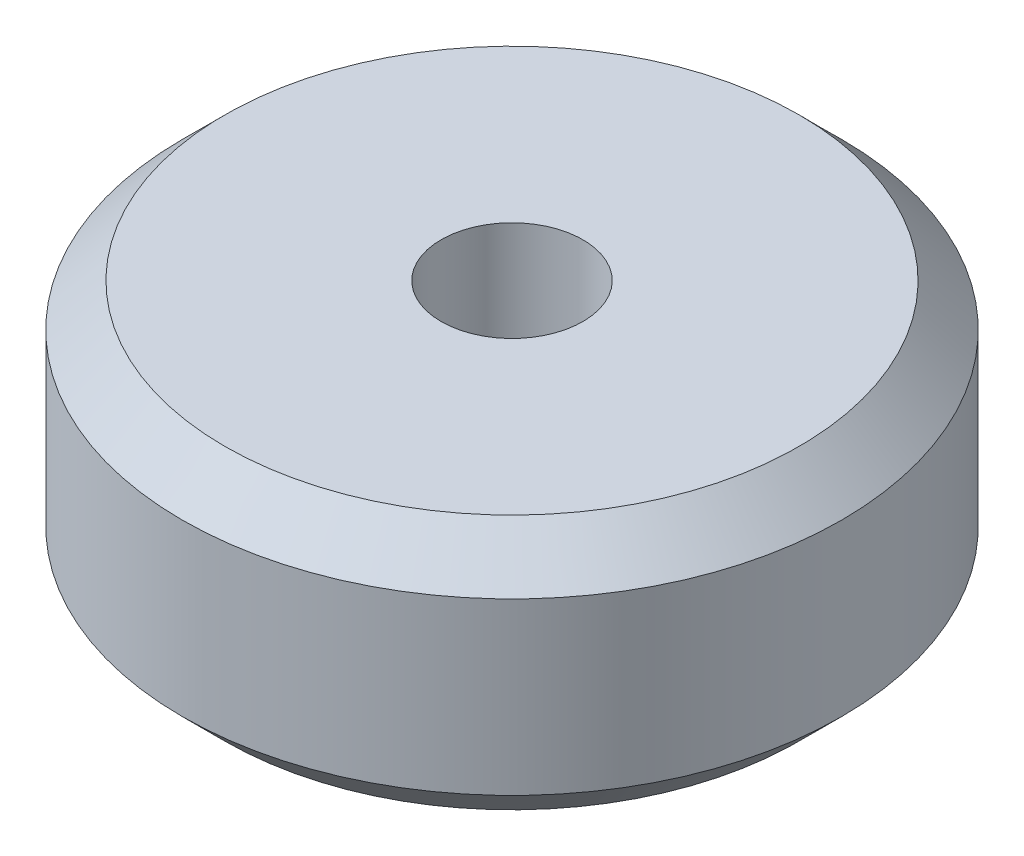
from build123d import *

# Parameters (mm, degrees)
SKETCH1_R           = 11.625
SKETCH1_R_2         = 2.5
BOSS_EXTRUDE1_DEPTH = 9
CHAMFER1_SIZE       = 1.5


with BuildPart() as part:
    # Sketch1 → Boss-Extrude1 (new body)
    with BuildSketch(Plane(origin=(0, 0, 0), x_dir=(1, 0, 0), z_dir=(0, 1, 0))):
        with Locations(Location((0, 0, 0), (0, 0, 270))):
            Circle(SKETCH1_R)
        with Locations(Location((0, 0, 0), (0, 0, 270))):
            Circle(SKETCH1_R_2, mode=Mode.SUBTRACT)
    extrude(amount=BOSS_EXTRUDE1_DEPTH)

    # Chamfer1
    chamfer1_edges = [part.edges().sort_by_distance(p)[0] for p in [
        (0, 0, -11.625),
        (0, 9, -11.625),
    ]]
    chamfer(chamfer1_edges, length=CHAMFER1_SIZE)


solid = part.part
